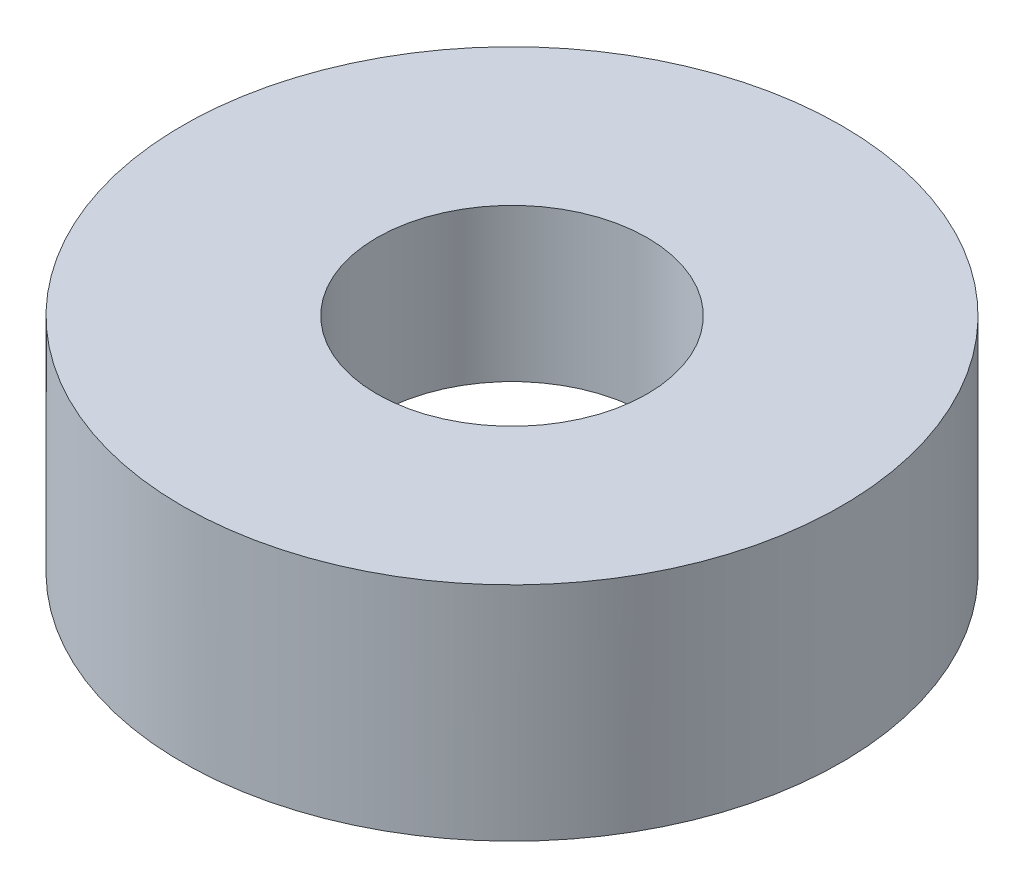
from build123d import *

# Parameters (mm, degrees)
SKIZZE1_R                       = 4.75
SKIZZE1_R_2                     = 1.95
AUFSATZ_LINEAR_AUSTRAGEN1_DEPTH = 2.2
AUFSATZ_LINEAR_START            = 1
SKIZZE2_R                       = 4.75
SKIZZE2_R_2                     = 4.25
AUFSATZ_LINEAR_AUSTRAGEN2_DEPTH = 1


with BuildPart() as part:
    # Skizze1 → Aufsatz-Linear austragen1 (new body)
    with BuildSketch(Plane(origin=(0, 0, 0), x_dir=(1, 0, 0), z_dir=(0, 1, 0))):
        with Locations(Location((0, 0, 0), (0, 0, 270))):
            Circle(SKIZZE1_R)
        with Locations(Location((0, 0, 0), (0, 0, 270))):
            Circle(SKIZZE1_R_2, mode=Mode.SUBTRACT)
    extrude(amount=AUFSATZ_LINEAR_AUSTRAGEN1_DEPTH)

    # Skizze2 → Aufsatz-Linear austragen2 (add)
    with BuildSketch(Plane.XZ.offset(AUFSATZ_LINEAR_START)):
        with Locations(Location((0, 0, 0), (0, 0, 270))):
            Circle(SKIZZE2_R)
        with Locations(Location((0, 0, 0), (0, 0, 270))):
            Circle(SKIZZE2_R_2, mode=Mode.SUBTRACT)
    extrude(amount=-AUFSATZ_LINEAR_AUSTRAGEN2_DEPTH)


solid = part.part
